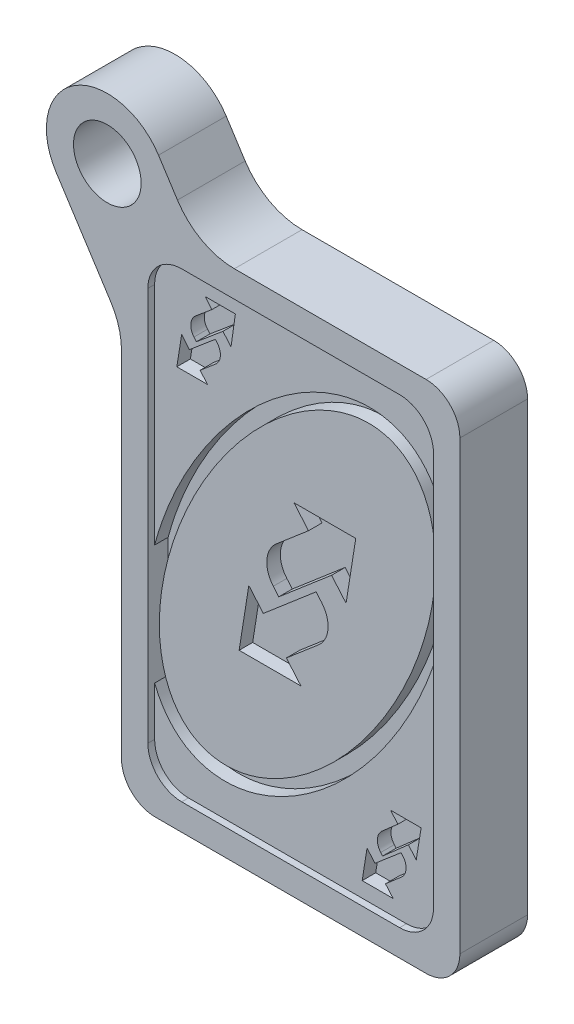
from build123d import *

# Parameters (mm, degrees)
SKETCH1_W           = 10
SKETCH1_H           = 15.2
BOSS_EXTRUDE1_DEPTH = 0.4
SKETCH1_3_W         = 10
SKETCH1_3_H         = 15.2
SKETCH1_3_RX        = 6.447289556
SKETCH1_3_RY        = 3.587568793
SKETCH1_3_RX_2      = 6.016925947
SKETCH1_3_RY_2      = 3.157568793
BOSS_EXTRUDE2_DEPTH = 0.8
SKETCH1_4_W         = 10
SKETCH1_4_H         = 15.2
SKETCH1_4_W_2       = 8.44
SKETCH1_4_H_2       = 13.64
BOSS_EXTRUDE3_DEPTH = 1
FILLET1_R           = 1
SKETCH2_R           = 1
BOSS_EXTRUDE4_DEPTH = 2
FILLET2_R           = 2


with BuildPart() as part:
    # Sketch1 → Boss-Extrude1 (new, symmetric)
    with BuildSketch(Plane.XY):
        with Locations((5, 7.6)):
            Rectangle(SKETCH1_W, SKETCH1_H)
    extrude(amount=BOSS_EXTRUDE1_DEPTH, both=True)

    # Sketch1<3> → Boss-Extrude2 (add, symmetric)
    # profile 1 of 2: a face of its own
    with BuildSketch(Plane.XY):
        with Locations((5, 7.6)):
            Rectangle(SKETCH1_3_W, SKETCH1_3_H)
        with Locations(Location((5, 7.6), (0, 0, -120.316314342))):
            Ellipse(SKETCH1_3_RX, SKETCH1_3_RY, mode=Mode.SUBTRACT)
        with BuildLine():
            Line((2.013248175, 12.570380578), (2.79925212, 13.230809928))
            Line((2.79925212, 13.230809928), (3.036644718, 12.948279301))
            Line((3.036644718, 12.948279301), (3.166035288, 13.857969409))
            Line((3.166035288, 13.857969409), (2.272289715, 13.857969409))
            Line((2.272289715, 13.857969409), (2.47045985, 13.622119038))
            Line((2.47045985, 13.622119038), (1.99070215, 13.219009018))
            ThreePointArc((1.99070215, 13.219009018), (1.849520441, 12.947359327), (1.941775235, 12.655443444))
            Line((1.941775235, 12.655443444), (2.013248175, 12.570380578))
        make_face(mode=Mode.SUBTRACT)
        with BuildLine():
            Line((2.573541086, 12.912762773), (1.807963278, 12.267050426))
            Line((1.807963278, 12.267050426), (1.578739925, 12.538825176))
            Line((1.578739925, 12.538825176), (1.436292724, 11.641246159))
            Line((1.436292724, 11.641246159), (2.341285421, 11.641246159))
            Line((2.341285421, 11.641246159), (2.125075804, 11.897591397))
            Line((2.125075804, 11.897591397), (2.581675695, 12.282702073))
            ThreePointArc((2.581675695, 12.282702073), (2.72234926, 12.554615255), (2.629548837, 12.846358141))
            Line((2.629548837, 12.846358141), (2.573541086, 12.912762773))
        make_face(mode=Mode.SUBTRACT)
        with BuildLine():
            Line((7.517372897, 2.16210975), (8.277665846, 2.828924058))
            Line((8.277665846, 2.828924058), (8.51075838, 2.563155))
            Line((8.51075838, 2.563155), (8.654696366, 3.452115))
            Line((8.654696366, 3.452115), (7.7510695, 3.452115))
            Line((7.7510695, 3.452115), (7.969285134, 3.203308389))
            Line((7.969285134, 3.203308389), (7.498428218, 2.790343716))
            ThreePointArc((7.498428218, 2.790343716), (7.36303426, 2.515763479), (7.461453822, 2.225867947))
            Line((7.461453822, 2.225867947), (7.517372897, 2.16210975))
        make_face(mode=Mode.SUBTRACT)
        with BuildLine():
            Line((7.291696407, 1.863373763), (8.063431346, 2.521185925))
            Line((8.063431346, 2.521185925), (8.112322941, 2.464655019))
            ThreePointArc((8.112322941, 2.464655019), (8.208731591, 2.174084541), (8.071438446, 1.900448977))
            Line((8.071438446, 1.900448977), (7.601212367, 1.493766963))
            Line((7.601212367, 1.493766963), (7.828929297, 1.230469263))
            Line((7.828929297, 1.230469263), (6.912689643, 1.230469263))
            Line((6.912689643, 1.230469263), (7.056197058, 2.135669885))
            Line((7.056197058, 2.135669885), (7.291696407, 1.863373763))
        make_face(mode=Mode.SUBTRACT)
    # profile 2 of 2: a face of its own
    with BuildSketch(Plane.XY):
        with Locations(Location((5, 7.6), (0, 0, -120.316314342))):
            Ellipse(SKETCH1_3_RX_2, SKETCH1_3_RY_2)
        with BuildLine():
            Line((4.44807564, 7.260257343), (6.008285351, 8.592364751))
            Line((6.008285351, 8.592364751), (6.437039799, 8.090192893))
            Line((6.437039799, 8.090192893), (6.723187539, 9.893073462))
            Line((6.723187539, 9.893073462), (4.897739957, 9.893073462))
            Line((4.897739957, 9.893073462), (5.326494404, 9.390901603))
            Line((5.326494404, 9.390901603), (4.374693723, 8.578253964))
            ThreePointArc((4.374693723, 8.578253964), (4.096629816, 8.03274156), (4.285744462, 7.450385165))
            Line((4.285744462, 7.450385165), (4.44807564, 7.260257343))
        make_face(mode=Mode.SUBTRACT)
        with BuildLine():
            Line((5.55192436, 7.939742657), (3.991714649, 6.607635249))
            Line((3.991714649, 6.607635249), (3.562960201, 7.109807107))
            Line((3.562960201, 7.109807107), (3.276812461, 5.306926538))
            Line((3.276812461, 5.306926538), (5.102260043, 5.306926538))
            Line((5.102260043, 5.306926538), (4.673505596, 5.809098397))
            Line((4.673505596, 5.809098397), (5.625306277, 6.621746036))
            ThreePointArc((5.625306277, 6.621746036), (5.903370184, 7.16725844), (5.714255538, 7.749614835))
            Line((5.714255538, 7.749614835), (5.55192436, 7.939742657))
        make_face(mode=Mode.SUBTRACT)
    extrude(amount=BOSS_EXTRUDE2_DEPTH, both=True)

    # Sketch1<4> → Boss-Extrude3 (add, symmetric)
    with BuildSketch(Plane.XY):
        with Locations((5, 7.6)):
            Rectangle(SKETCH1_4_W, SKETCH1_4_H)
        with Locations((5, 7.6)):
            Rectangle(SKETCH1_4_W_2, SKETCH1_4_H_2, mode=Mode.SUBTRACT)
    extrude(amount=BOSS_EXTRUDE3_DEPTH, both=True)

    # Fillet1
    fillet1_edges = [part.edges().sort_by_distance(p)[0] for p in [
        (10, 15.2, 0),
        (10, 0, 0),
        (0, 0, 0),
        (0, 15.2, 0),
        (0.78, 14.42, -0.9),
        (0.78, 6.751239794, -0.5999997),
        (9.22, 11.980450807, -0.5999997),
        (9.22, 14.42, -0.9),
        (0.78, 0.78, 0.9),
        (9.22, 0.78, 0.9),
        (9.22, 14.42, 0.9),
        (0.78, 14.42, 0.9),
    ]]
    fillet(fillet1_edges, radius=FILLET1_R)

    # Sketch2 → Boss-Extrude4 (add)
    with BuildSketch(Plane.XY.offset(1)):
        with BuildLine():
            Line((-1.931298917, 15.03602465), (0, 12.037960643))
            Line((0, 12.037960643), (0, 14.2))
            ThreePointArc((0, 14.2), (0.292893219, 14.907106781), (1, 15.2))
            Line((1, 15.2), (2.245362238, 15.2))
            Line((2.245362238, 15.2), (1.095118394, 16.985588256))
            ThreePointArc((1.095118394, 16.985588256), (-1.392872065, 17.524015109), (-1.931298917, 15.03602465))
        make_face()
        with Locations((-0.418090261, 16.010806453)):
            Circle(SKETCH2_R, mode=Mode.SUBTRACT)
    extrude(amount=-BOSS_EXTRUDE4_DEPTH)

    # Fillet2
    fillet2_edges = [part.edges().sort_by_distance(p)[0] for p in [
        (2.245362238, 15.2, 0),
        (0, 12.037960643, 0),
    ]]
    fillet(fillet2_edges, radius=FILLET2_R)


solid = part.part
